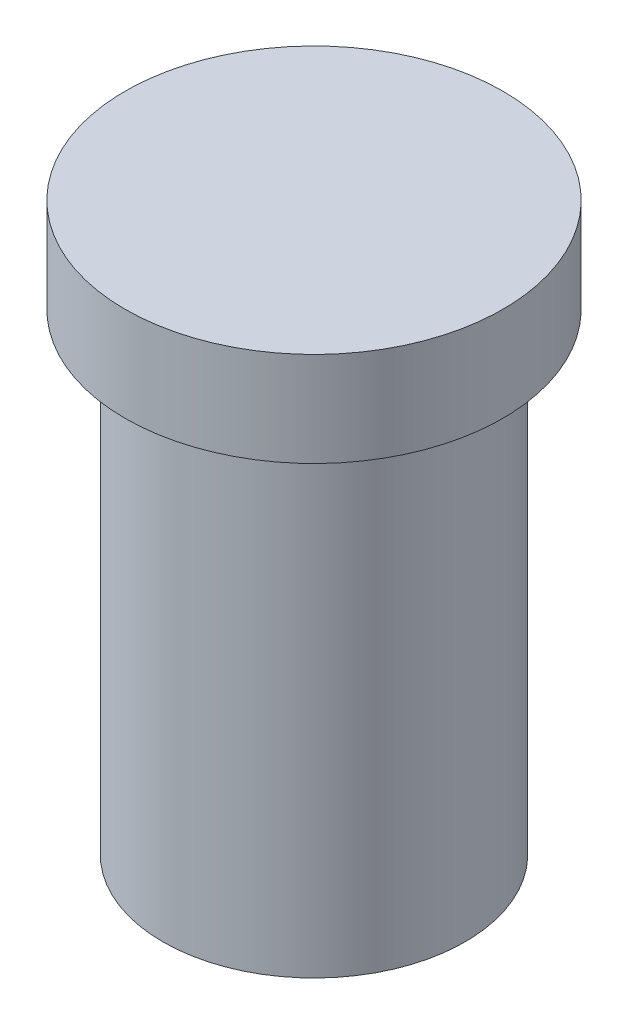
from build123d import *

# Parameters (mm, degrees)
SKETCH1_R           = 400
BOSS_EXTRUDE1_DEPTH = 1250
SKETCH2_R           = 500
BOSS_EXTRUDE2_DEPTH = 250


with BuildPart() as part:
    # Sketch1 → Boss-Extrude1 (new body)
    with BuildSketch(Plane(origin=(0, 0, 0), x_dir=(1, 0, 0), z_dir=(0, 1, 0))):
        with Locations(Location((0, 0, 0), (0, 0, 270))):
            Circle(SKETCH1_R)
    extrude(amount=BOSS_EXTRUDE1_DEPTH)

    # Sketch2 → Boss-Extrude2 (add)
    with BuildSketch(Plane(origin=(0, 1250, 0), x_dir=(1, 0, 0), z_dir=(0, 1, 0))):
        with Locations(Location((0, 0, 0), (0, 0, 270))):
            Circle(SKETCH2_R)
    extrude(amount=BOSS_EXTRUDE2_DEPTH)


solid = part.part
